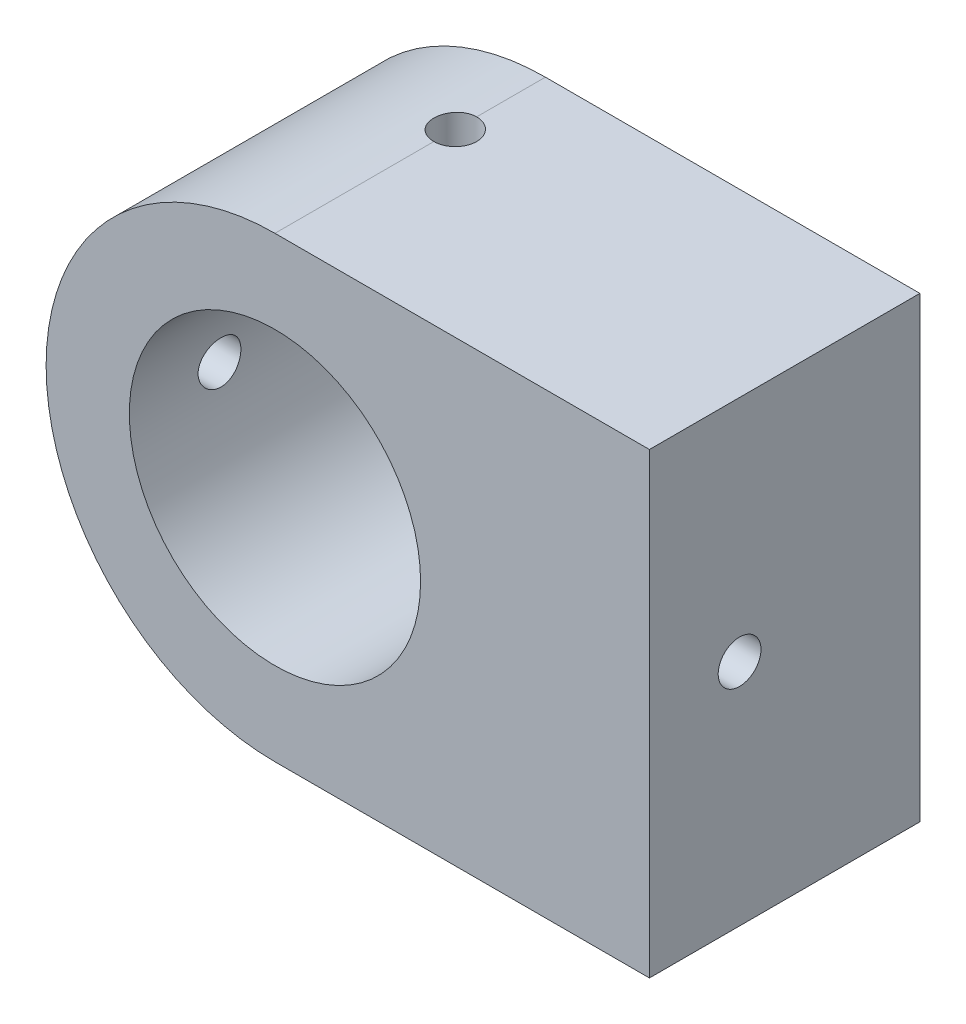
from build123d import *

# Parameters (mm, degrees)
SKETCH1_R               = 22.225
BOSS_EXTRUDE1_DEPTH     = 41.275
CUT_EXTRUDE1_DEPTH      = 79.673399253
CUT_EXTRUDE1_DEPTH_BACK = 79.673399253
SKETCH2_R               = 3.2639
CUT_EXTRUDE2_DEPTH      = 79.673399422
CUT_EXTRUDE2_DEPTH_BACK = 79.673399422
SKETCH3_R               = 3.2639


with BuildPart() as part:
    # Sketch1 → Boss-Extrude1 (new body)
    with BuildSketch(Plane(origin=(0, 0, 0), x_dir=(0, 1, 0), z_dir=(0, 0, 1))):
        with BuildLine():
            Line((-34.925, 0), (-34.925, -57.15))
            Line((-34.925, -57.15), (34.925, -57.15))
            Line((34.925, -57.15), (34.925, 0))
            ThreePointArc((34.925, 0), (0, 34.925), (-34.925, 0))
        make_face()
        with Locations(Location((0, 0, 0), (0, 0, 270))):
            Circle(SKETCH1_R, mode=Mode.SUBTRACT)
    extrude(amount=BOSS_EXTRUDE1_DEPTH)

    # Sketch2 → Cut-Extrude1 (cut, two sides: drawn at the far end of the back side and taken through both)
    with BuildSketch(Plane.YZ.offset(-CUT_EXTRUDE1_DEPTH_BACK)):
        with Locations(Location((0, 27.516666667, 0), (0, 0, 270))):
            Circle(SKETCH2_R)
    extrude(amount=CUT_EXTRUDE1_DEPTH + CUT_EXTRUDE1_DEPTH_BACK, mode=Mode.SUBTRACT)

    # Sketch3 → Cut-Extrude2 (cut, two sides: drawn at the far end of the back side and taken through both)
    with BuildSketch(Plane(origin=(0, 0, 0), x_dir=(-1, 0, 0), z_dir=(0, 1, 0)).offset(-CUT_EXTRUDE2_DEPTH_BACK)):
        with Locations(Location((0, 13.758333333, 0), (0, 0, 90))):
            Circle(SKETCH3_R)
    extrude(amount=CUT_EXTRUDE2_DEPTH + CUT_EXTRUDE2_DEPTH_BACK, mode=Mode.SUBTRACT)


solid = part.part
